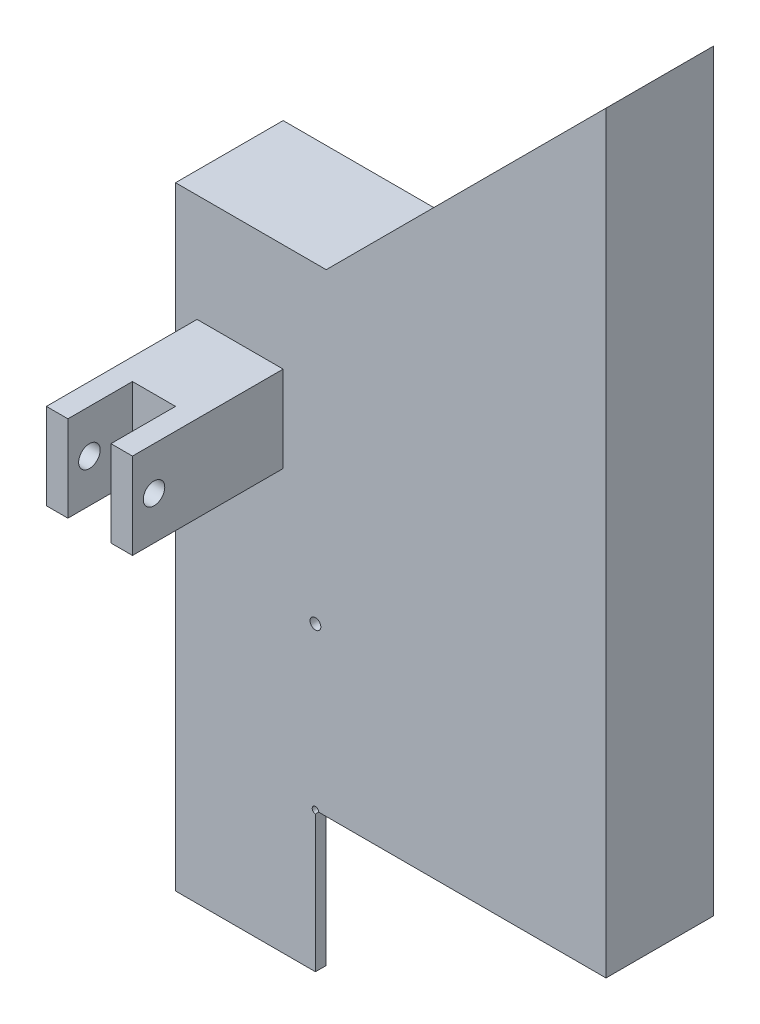
from build123d import *

# Parameters (mm, degrees)
P_IDAT_VYSUNUT_M1_DEPTH  = 50
SKICA2_W                 = 130
SKICA2_H                 = 5
P_IDAT_VYSUNUT_M2_DEPTH  = 65
SKICA3_W                 = 65
SKICA3_H                 = 65
ODEBRAT_VYSUNUT_M1_DEPTH = 5
SKICA4_W                 = 40
SKICA4_H                 = 40
P_IDAT_VYSUNUT_M3_DEPTH  = 40
SKICA5_W                 = 10
SKICA5_H                 = 40
P_IDAT_VYSUNUT_M4_DEPTH  = 30
SKICA6_R                 = 5
ODEBRAT_VYSUNUT_M2_DEPTH = 40
SKICA7_R                 = 2.5
ODEBRAT_VYSUNUT_M3_DEPTH = 55
SKICA8_R                 = 1.5
ODEBRAT_VYSUNUT_M4_DEPTH = 50


with BuildPart() as part:
    # Skica1 → Přidat vysunutím1 (new body)
    with BuildSketch(Plane.XY):
        Polygon((0, 0), (200, 0), (200, 350), (70, 220), (0, 220), align=None)
    extrude(amount=P_IDAT_VYSUNUT_M1_DEPTH)

    # Skica2 → Přidat vysunutím2 (add)
    with BuildSketch(Plane.XZ):
        with Locations((65, 47.5)):
            Rectangle(SKICA2_W, SKICA2_H)
    extrude(amount=P_IDAT_VYSUNUT_M2_DEPTH)

    # Skica3 → Odebrat vysunutím1 (cut)
    with BuildSketch(Plane.XY.offset(50)):
        with Locations((97.5, -32.5)):
            Rectangle(SKICA3_W, SKICA3_H)
    extrude(amount=-ODEBRAT_VYSUNUT_M1_DEPTH, mode=Mode.SUBTRACT)

    # Skica4 → Přidat vysunutím3 (add)
    with BuildSketch(Plane.XY.offset(50)):
        with Locations((30, 150)):
            Rectangle(SKICA4_W, SKICA4_H)
    extrude(amount=P_IDAT_VYSUNUT_M3_DEPTH)

    # Skica5 → Přidat vysunutím4 (add)
    with BuildSketch(Plane.XY.offset(90)):
        with Locations((15, 150)):
            Rectangle(SKICA5_W, SKICA5_H)
        with Locations((45, 150)):
            Rectangle(SKICA5_W, SKICA5_H)
    extrude(amount=P_IDAT_VYSUNUT_M4_DEPTH)

    # Skica6 → Odebrat vysunutím2 (cut)
    with BuildSketch(Plane(origin=(50, 0, 0), x_dir=(0, 0, -1), z_dir=(1, 0, 0))):
        with Locations(Location((-110, 150, 0), (0, 0, 90))):
            Circle(SKICA6_R)
    extrude(amount=-ODEBRAT_VYSUNUT_M2_DEPTH, mode=Mode.SUBTRACT)

    # Skica7 → Odebrat vysunutím3 (cut)
    with BuildSketch(Plane.XY.offset(50)):
        with Locations((65, 75)):
            Circle(SKICA7_R)
    extrude(amount=-ODEBRAT_VYSUNUT_M3_DEPTH, mode=Mode.SUBTRACT)

    # Skica8 → Odebrat vysunutím4 (cut)
    with BuildSketch(Plane.XY.offset(50)):
        with Locations((65, 0)):
            Circle(SKICA8_R)
    extrude(amount=-ODEBRAT_VYSUNUT_M4_DEPTH, mode=Mode.SUBTRACT)


solid = part.part
